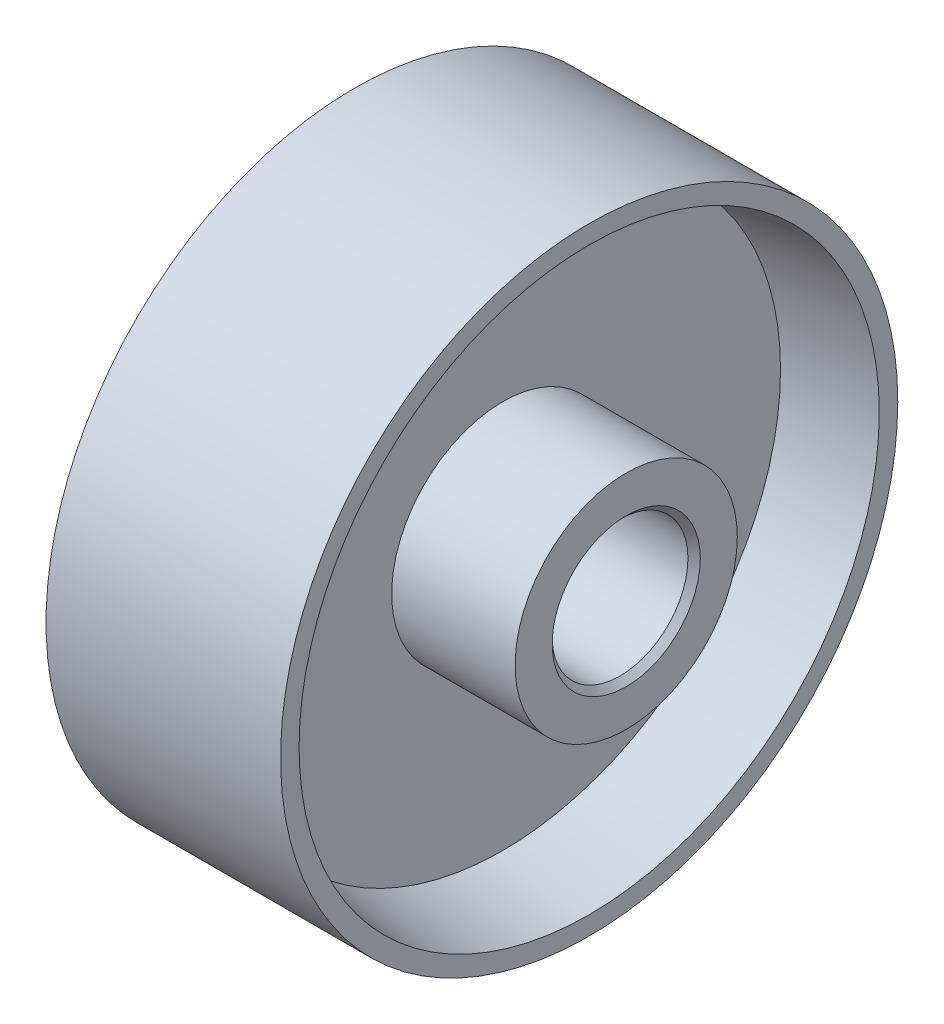
from build123d import *

# Parameters (mm, degrees)
CHANFREIN1_SIZE = 1


with BuildPart() as part:
    # Esquisse1 → Révolution1 (revolve)
    with BuildSketch(Plane.XY, mode=Mode.PRIVATE) as r_volution1_sk:
        Polygon((-25, 11), (25, 11), (25, 18), (5, 18), (5, 45), (19, 47), (19, 50), (-19, 50), (-19, 47), (-5, 45), (-5, 18), (-25, 18), align=None)
    revolve(r_volution1_sk.sketch.rotate(Axis((-40.635842881, 0, 0), (1, 0, 0)), 270), axis=Axis((-40.635842881, 0, 0), (1, 0, 0)))

    # Chanfrein1
    chanfrein1_edges = [part.edges().sort_by_distance(p)[0] for p in [
        (-25, 0, 11),
        (25, 0, 11),
    ]]
    chamfer(chanfrein1_edges, length=CHANFREIN1_SIZE)


solid = part.part
